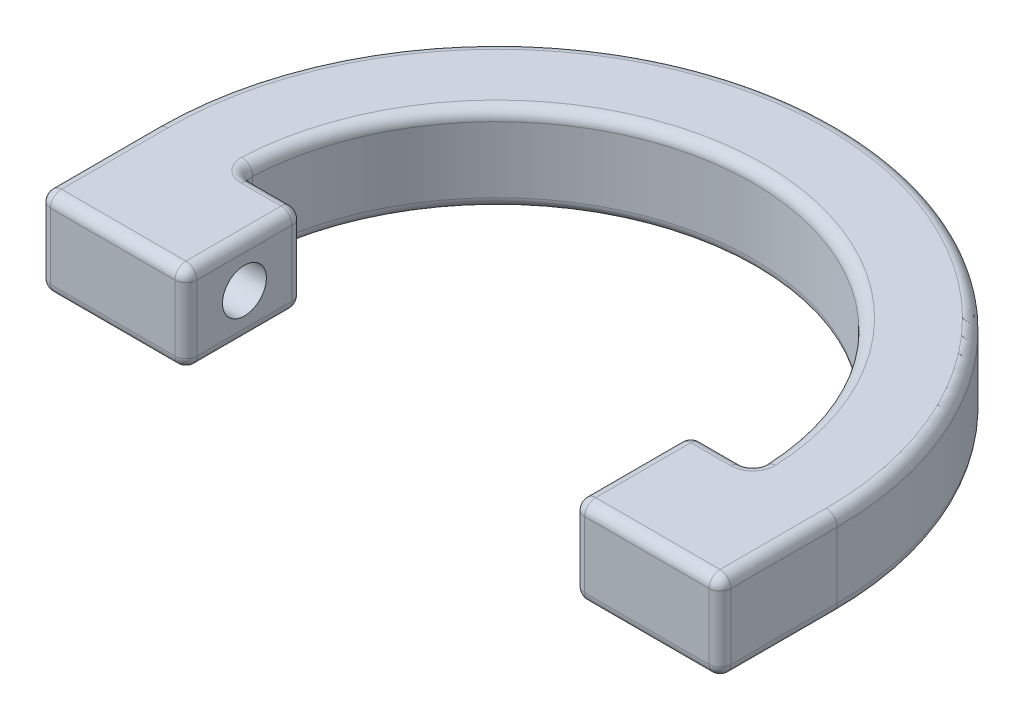
from build123d import *

# Parameters (mm, degrees)
BOSS_EXTRU_1_DEPTH      = 6
CONG_1_R                = 0.75
ESQUISSE2_R             = 1.5
ENL_V_MAT_EXTRU_1_DEPTH = 6
ENL_V_START             = -6
ESQUISSE3_R             = 1.5
ENL_V_MAT_EXTRU_2_DEPTH = 6


with BuildPart() as part:
    # Esquisse1 → Boss.-Extru.1 (new body)
    with BuildSketch(Plane(origin=(0, -27.53, 0), x_dir=(-1, 0, 0), z_dir=(0, 1, 0))):
        with BuildLine():
            Line((-23.997779507, -61.133700741), (-13.997779507, -61.133700741))
            Line((-13.997779507, -61.133700741), (-13.997779507, -69.133700741))
            Line((-13.997779507, -69.133700741), (-18.247779507, -69.133700741))
            ThreePointArc((-18.247779507, -69.133700741), (-0.747779507, -86.633700741), (16.752220493, -69.133700741))
            Line((16.752220493, -69.133700741), (12.502220493, -69.133700741))
            Line((12.502220493, -69.133700741), (12.502220493, -61.133700741))
            Line((12.502220493, -61.133700741), (22.502220493, -61.133700741))
            Line((22.502220493, -61.133700741), (22.502220493, -69.133700741))
            ThreePointArc((22.502220493, -69.133700741), (-0.747779507, -92.383700741), (-23.997779507, -69.133700741))
            Line((-23.997779507, -69.133700741), (-23.997779507, -61.133700741))
        make_face()
    extrude(amount=BOSS_EXTRU_1_DEPTH)

    # Congé1
    cong_1_edges = [part.edges().sort_by_distance(p)[0] for p in [
        (23.997779507, -21.53, -65.133700741),
        (-14.627220493, -27.53, -69.133700741),
        (-12.502220493, -27.53, -65.133700741),
        (-17.502220493, -27.53, -61.133700741),
        (-22.502220493, -27.53, -65.133700741),
        (0.747779507, -27.53, -92.383700741),
        (23.997779507, -27.53, -65.133700741),
        (18.997779507, -27.53, -61.133700741),
        (13.997779507, -27.53, -65.133700741),
        (0.747779507, -21.53, -92.383700741),
        (-22.502220493, -21.53, -65.133700741),
        (13.997779507, -24.53, -69.133700741),
        (18.247779507, -24.53, -69.133700741),
        (-16.752220493, -24.53, -69.133700741),
        (-12.502220493, -24.53, -69.133700741),
        (-12.502220493, -24.53, -61.133700741),
        (-22.502220493, -24.53, -61.133700741),
        (23.997779507, -24.53, -61.133700741),
        (13.997779507, -24.53, -61.133700741),
        (-17.502220493, -21.53, -61.133700741),
        (-12.502220493, -21.53, -65.133700741),
        (-14.627220493, -21.53, -69.133700741),
        (0.747779507, -21.53, -86.633700741),
        (16.122779507, -21.53, -69.133700741),
        (13.997779507, -21.53, -65.133700741),
        (18.997779507, -21.53, -61.133700741),
        (16.122779507, -27.53, -69.133700741),
        (0.747779507, -27.53, -86.633700741),
    ]]
    fillet(cong_1_edges, radius=CONG_1_R)

    # Esquisse2 → Enlèv. mat.-Extru.1 (cut)
    with BuildSketch(Plane(origin=(-12.502220493, 0, 0), x_dir=(0, 0, -1), z_dir=(1, 0, 0))):
        with Locations((65.133700741, -24.53)):
            Circle(ESQUISSE2_R)
    extrude(amount=-ENL_V_MAT_EXTRU_1_DEPTH, mode=Mode.SUBTRACT)

    # Esquisse3 → Enlèv. mat.-Extru.2 (cut)
    with BuildSketch(Plane.ZY.offset(-13.997779507).offset(ENL_V_START)):
        with Locations(Location((-65.133700741, -24.53, 0), (0, 0, 180))):
            Circle(ESQUISSE3_R)
    extrude(amount=ENL_V_MAT_EXTRU_2_DEPTH, mode=Mode.SUBTRACT)


solid = part.part
